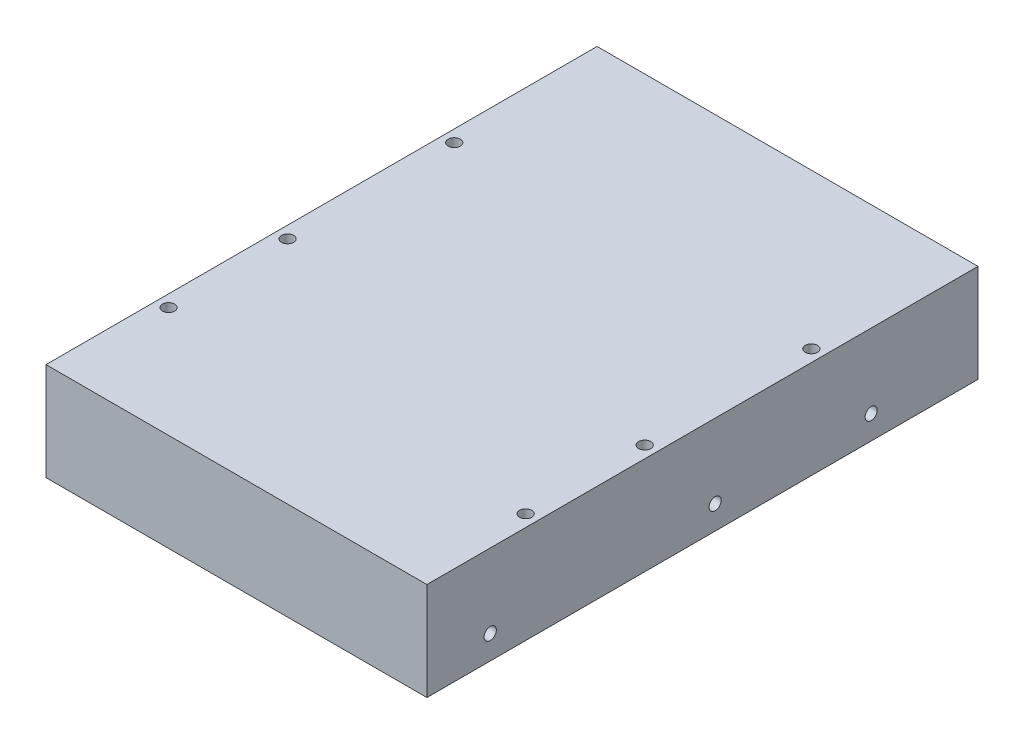
from build123d import *

# Parameters (mm, degrees)
SKETCH_1_W          = 101.6
SKETCH_1_H          = 146.9898
EXTRUDE_1_DEPTH     = 26.1112
SKETCH_1_3_R        = 1.6256
CUT_EXTRUDE_1_DEPTH = 6.35
SKETCH_2_R          = 1.6256
CUT_EXTRUDE_2_DEPTH = 4.7752


with BuildPart() as part:
    # 스케치1 → 보스-돌출1 (new body)
    with BuildSketch(Plane(origin=(0, 0, 0), x_dir=(1, 0, 0), z_dir=(0, 1, 0))):
        with Locations((50.8, 73.4949)):
            Rectangle(SKETCH_1_W, SKETCH_1_H)
    extrude(amount=-EXTRUDE_1_DEPTH)

    # 스케치1<3> → 컷-돌출1 (cut)
    with BuildSketch(Plane(origin=(0, 0, 0), x_dir=(1, 0, 0), z_dir=(0, 1, 0))):
        with Locations((3.175, 105.7148)):
            Circle(SKETCH_1_3_R)
        with Locations((98.425, 105.7148)):
            Circle(SKETCH_1_3_R)
        with Locations((3.175, 61.2648)):
            Circle(SKETCH_1_3_R)
        with Locations((98.425, 61.2648)):
            Circle(SKETCH_1_3_R)
        with Locations((3.175, 29.5148)):
            Circle(SKETCH_1_3_R)
        with Locations((98.425, 29.5148)):
            Circle(SKETCH_1_3_R)
    extrude(amount=-CUT_EXTRUDE_1_DEPTH, mode=Mode.SUBTRACT)

    # 스케치2 → 컷-돌출2 (cut)
    with BuildSketch(Plane(origin=(101.6, 0, 0), x_dir=(0, 0, -1), z_dir=(1, 0, 0))):
        with Locations((16.891, -19.7612)):
            Circle(SKETCH_2_R)
        with Locations((76.8858, -19.7612)):
            Circle(SKETCH_2_R)
        with Locations((118.491, -19.7612)):
            Circle(SKETCH_2_R)
    cut_extrude_2 = extrude(amount=-CUT_EXTRUDE_2_DEPTH, mode=Mode.SUBTRACT)

    # 대칭 복사1: 컷-돌출2 across plane
    add(cut_extrude_2.mirror(Plane(origin=(50.8, 0, 0), x_dir=(0, 0, 1), z_dir=(1, 0, 0))), mode=Mode.SUBTRACT)


solid = part.part
